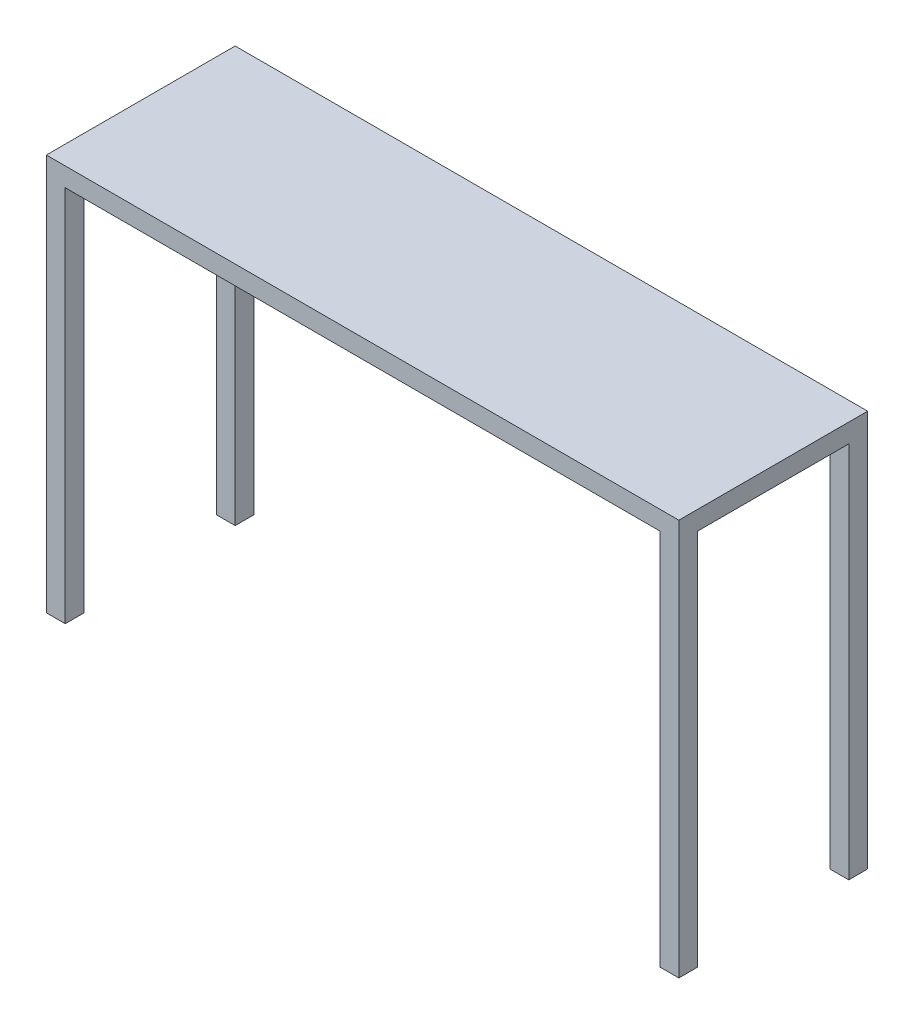
from build123d import *

# Parameters (mm, degrees)
SKETCH1_W           = 1701.8
SKETCH1_H           = 508
BOSS_EXTRUDE1_DEPTH = 50.8
SKETCH2_W           = 50.8
SKETCH2_H           = 50.8
BOSS_EXTRUDE2_DEPTH = 1016


with BuildPart() as part:
    # Sketch1 → Boss-Extrude1 (new body)
    with BuildSketch(Plane(origin=(0, 0, 0), x_dir=(1, 0, 0), z_dir=(0, 1, 0))):
        Rectangle(SKETCH1_W, SKETCH1_H)
    extrude(amount=BOSS_EXTRUDE1_DEPTH)

    # Sketch2 → Boss-Extrude2 (add)
    with BuildSketch(Plane.XZ):
        with Locations((-825.5, 228.6)):
            Rectangle(SKETCH2_W, SKETCH2_H)
        with Locations((-825.5, -228.6)):
            Rectangle(SKETCH2_W, SKETCH2_H)
        with Locations((825.5, 228.6)):
            Rectangle(SKETCH2_W, SKETCH2_H)
        with Locations((825.5, -228.6)):
            Rectangle(SKETCH2_W, SKETCH2_H)
    extrude(amount=BOSS_EXTRUDE2_DEPTH)


solid = part.part
